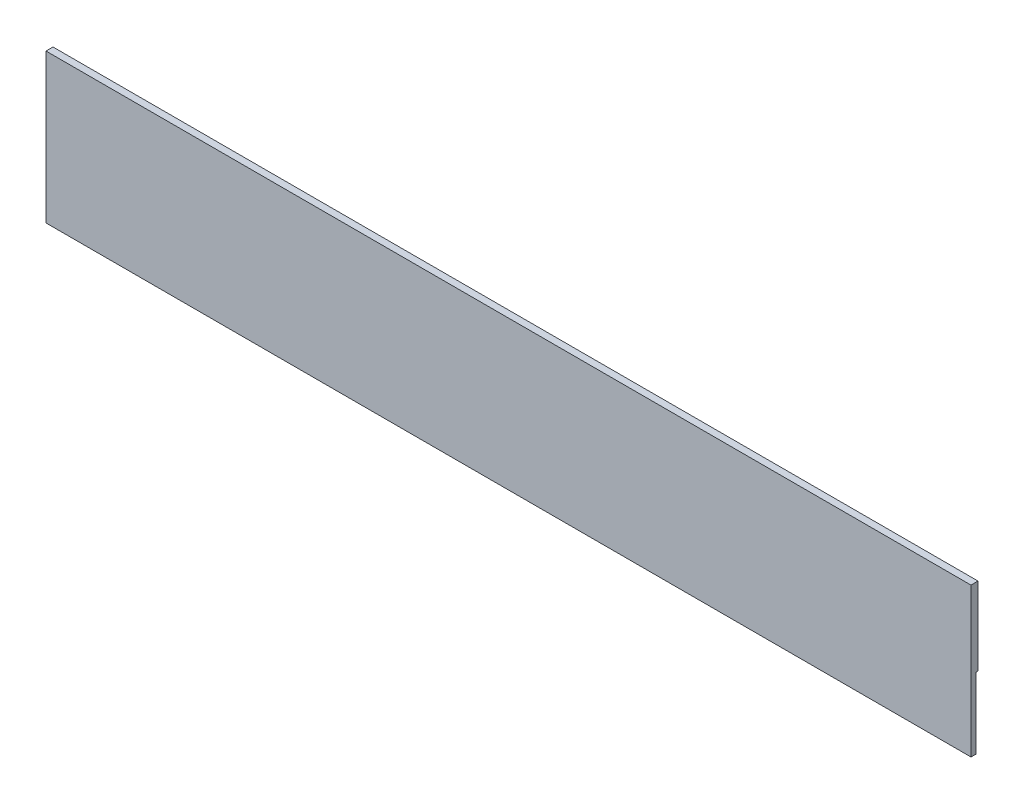
from build123d import *

# Parameters (mm, degrees)
SKETCH2_W           = 13411.2
SKETCH2_H           = 2159
BOSS_EXTRUDE1_DEPTH = 76.2
SKETCH4_W           = 13411.2
SKETCH4_H           = 1130.3
BOSS_EXTRUDE2_DEPTH = 25.4


with BuildPart() as part:
    # Sketch2 → Boss-Extrude1 (new body)
    with BuildSketch(Plane.XY):
        with Locations((6705.6, 1079.5)):
            Rectangle(SKETCH2_W, SKETCH2_H)
    extrude(amount=BOSS_EXTRUDE1_DEPTH)

    # Sketch4 → Boss-Extrude2 (add)
    with BuildSketch(Plane(origin=(0, 0, 0), x_dir=(-1, 0, 0), z_dir=(0, 0, -1))):
        with Locations((-6705.6, 1593.85)):
            Rectangle(SKETCH4_W, SKETCH4_H)
    extrude(amount=BOSS_EXTRUDE2_DEPTH)


solid = part.part
